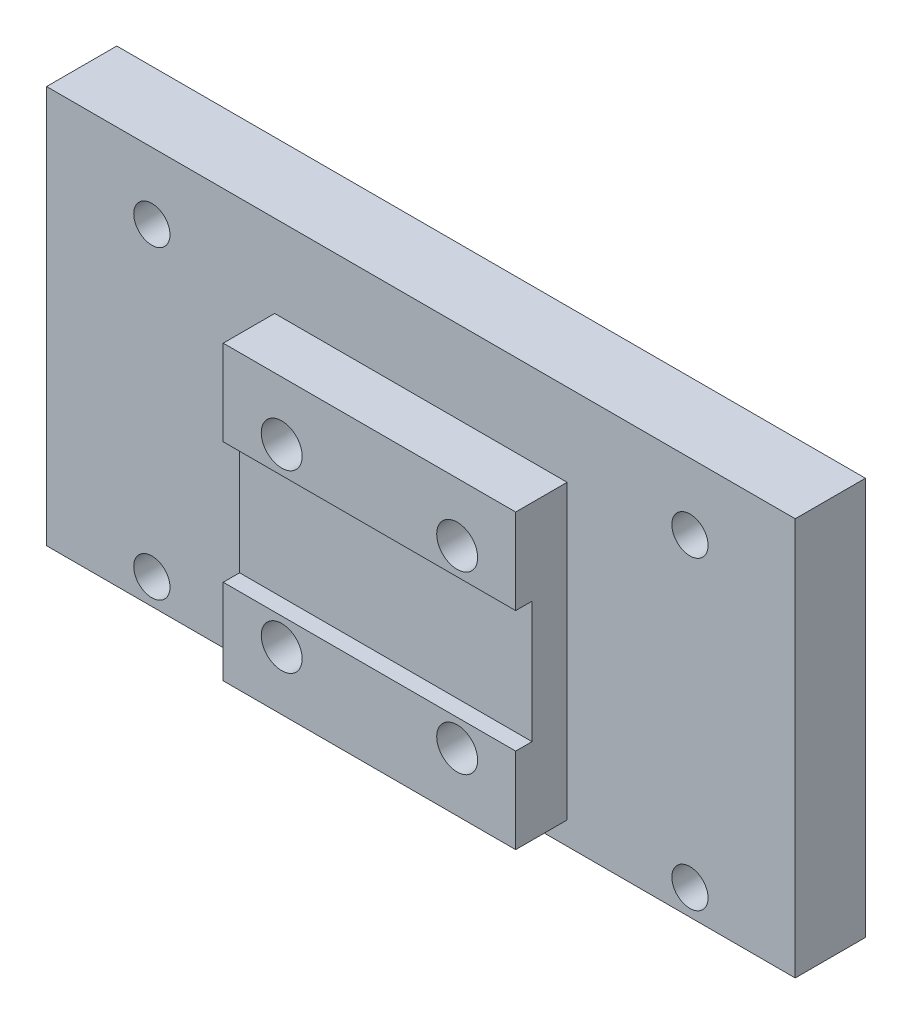
from build123d import *

# Parameters (mm, degrees)
SKETCH_1_W          = 25
SKETCH_1_H          = 25
SKETCH_1_R          = 1.75
EXTRUDE_1_DEPTH     = 3
SKETCH_2_W          = 25
SKETCH_2_H          = 7.3
EXTRUDE_2_DEPTH     = 1.4
SKETCH_3_R          = 1.75
CUT_EXTRUDE_1_DEPTH = 36.628078814
SKETCH_6_W          = 64
SKETCH_6_H          = 36.1
EXTRUDE_5_DEPTH     = 6
SKETCH_7_W          = 25
SKETCH_7_H          = 22
CUT_EXTRUDE_2_DEPTH = 5
SKETCH_3_2_R        = 1.75
CUT_EXTRUDE_5_DEPTH = 56.817671933
SKETCH_9_W          = 64
SKETCH_9_H          = 2.1
CUT_EXTRUDE_6_DEPTH = 10
SKETCH_10_R         = 1.55
CUT_EXTRUDE_7_DEPTH = 57.318779284


with BuildPart() as part:
    # 草图1 → 凸台-拉伸1 (new body)
    with BuildSketch(Plane.XY):
        with Locations((12.5, 12.5)):
            Rectangle(SKETCH_1_W, SKETCH_1_H)
        with Locations((5, 20)):
            Circle(SKETCH_1_R, mode=Mode.SUBTRACT)
        with Locations((20, 20)):
            Circle(SKETCH_1_R, mode=Mode.SUBTRACT)
        with Locations((5, 5)):
            Circle(SKETCH_1_R, mode=Mode.SUBTRACT)
        with Locations((20, 5)):
            Circle(SKETCH_1_R, mode=Mode.SUBTRACT)
    extrude(amount=EXTRUDE_1_DEPTH)

    # 草图2 → 凸台-拉伸2 (add)
    with BuildSketch(Plane.XY.offset(3)):
        with Locations((12.5, 21.35)):
            Rectangle(SKETCH_2_W, SKETCH_2_H)
        with Locations((12.5, 3.65)):
            Rectangle(SKETCH_2_W, SKETCH_2_H)
    extrude(amount=EXTRUDE_2_DEPTH)

    # 草图3 → 切除-拉伸1 (cut, through all)
    with BuildSketch(Plane.XY.offset(4.4)):
        with Locations((5, 5)):
            Circle(SKETCH_3_R)
        with Locations((20, 5)):
            Circle(SKETCH_3_R)
        with Locations((20, 20)):
            Circle(SKETCH_3_R)
        with Locations((5, 20)):
            Circle(SKETCH_3_R)
    extrude(amount=-CUT_EXTRUDE_1_DEPTH, mode=Mode.SUBTRACT)

    # 草图6 → 凸台-拉伸5 (add)
    with BuildSketch(Plane(origin=(0, 0, 0), x_dir=(-1, 0, 0), z_dir=(0, 0, -1))):
        with Locations((-12.5, 14)):
            Rectangle(SKETCH_6_W, SKETCH_6_H)
    extrude(amount=EXTRUDE_5_DEPTH)

    # 草图7 → 切除-拉伸2 (cut)
    with BuildSketch(Plane(origin=(0, 0, -6), x_dir=(-1, 0, 0), z_dir=(0, 0, -1))):
        with Locations((-12.5, 14)):
            Rectangle(SKETCH_7_W, SKETCH_7_H)
    extrude(amount=-CUT_EXTRUDE_2_DEPTH, mode=Mode.SUBTRACT)

    # 草图3<2> → 切除-拉伸5 (cut, through all)
    with BuildSketch(Plane.XY.offset(4.4)):
        with Locations((5, 5)):
            Circle(SKETCH_3_2_R)
        with Locations((20, 5)):
            Circle(SKETCH_3_2_R)
        with Locations((20, 20)):
            Circle(SKETCH_3_2_R)
        with Locations((5, 20)):
            Circle(SKETCH_3_2_R)
    extrude(amount=-CUT_EXTRUDE_5_DEPTH, mode=Mode.SUBTRACT)

    # 草图9 → 切除-拉伸6 (cut)
    with BuildSketch(Plane.XY):
        with Locations((12.5, -3)):
            Rectangle(SKETCH_9_W, SKETCH_9_H)
    extrude(amount=-CUT_EXTRUDE_6_DEPTH, mode=Mode.SUBTRACT)

    # 草图10 → 切除-拉伸7 (cut, through all)
    with BuildSketch(Plane.XY.offset(-8.42)):
        with Locations((-10.5, 26.35)):
            Circle(SKETCH_10_R)
        with Locations((35.5, 26.35)):
            Circle(SKETCH_10_R)
        with Locations((35.5, 0.25)):
            Circle(SKETCH_10_R)
        with Locations((-10.5, 0.25)):
            Circle(SKETCH_10_R)
    extrude(amount=CUT_EXTRUDE_7_DEPTH, mode=Mode.SUBTRACT)


solid = part.part
